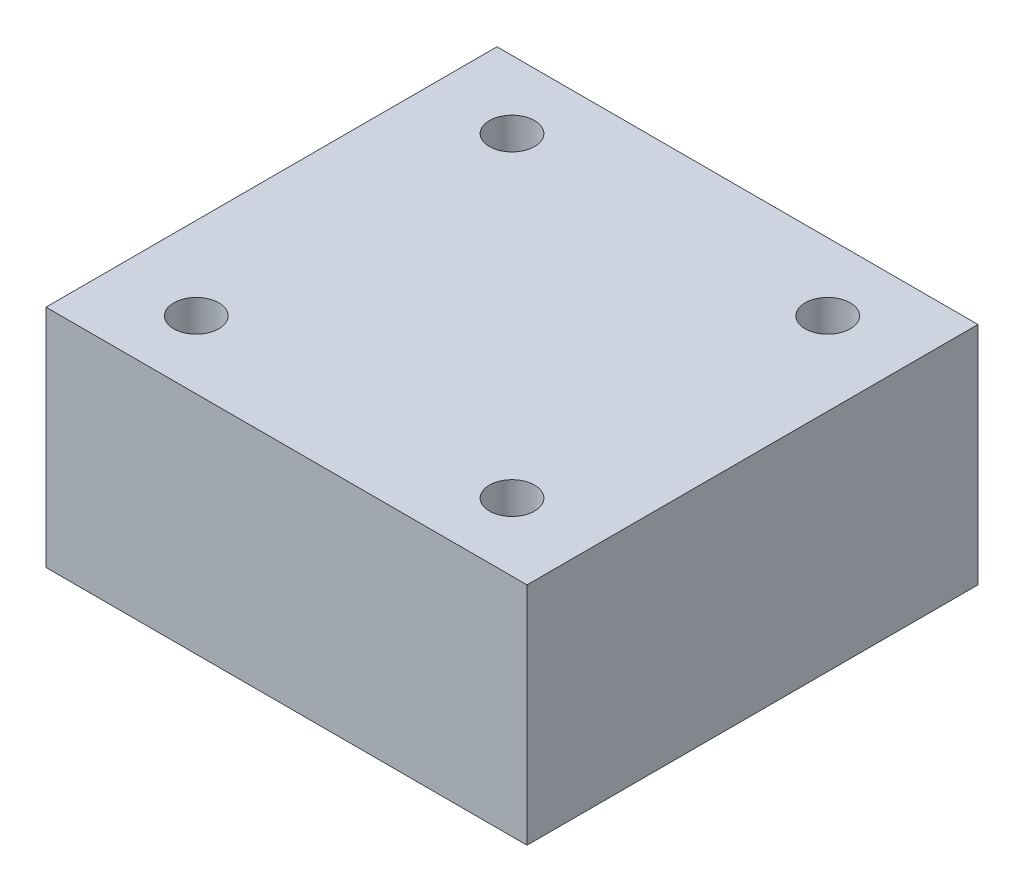
from build123d import *

# Parameters (mm, degrees)
SKETCH1_W           = 32
SKETCH1_H           = 30
BOSS_EXTRUDE1_DEPTH = 15
SKETCH2_R           = 1.5
CUT_EXTRUDE1_DEPTH  = 15


with BuildPart() as part:
    # Sketch1 → Boss-Extrude1 (new body)
    with BuildSketch(Plane(origin=(0, 0, 0), x_dir=(1, 0, 0), z_dir=(0, 1, 0))):
        with Locations((16, 15)):
            Rectangle(SKETCH1_W, SKETCH1_H)
    extrude(amount=BOSS_EXTRUDE1_DEPTH)

    # Sketch2 → Cut-Extrude1 (cut)
    with BuildSketch(Plane(origin=(0, 15, 0), x_dir=(1, 0, 0), z_dir=(0, 1, 0))):
        with Locations(Location((5.5, 4.5, 0), (0, 0, 270))):
            Circle(SKETCH2_R)
        with Locations(Location((5.5, 25.5, 0), (0, 0, 270))):
            Circle(SKETCH2_R)
        with Locations(Location((26.5, 25.5, 0), (0, 0, 270))):
            Circle(SKETCH2_R)
        with Locations(Location((26.5, 4.5, 0), (0, 0, 270))):
            Circle(SKETCH2_R)
    extrude(amount=-CUT_EXTRUDE1_DEPTH, mode=Mode.SUBTRACT)


solid = part.part
